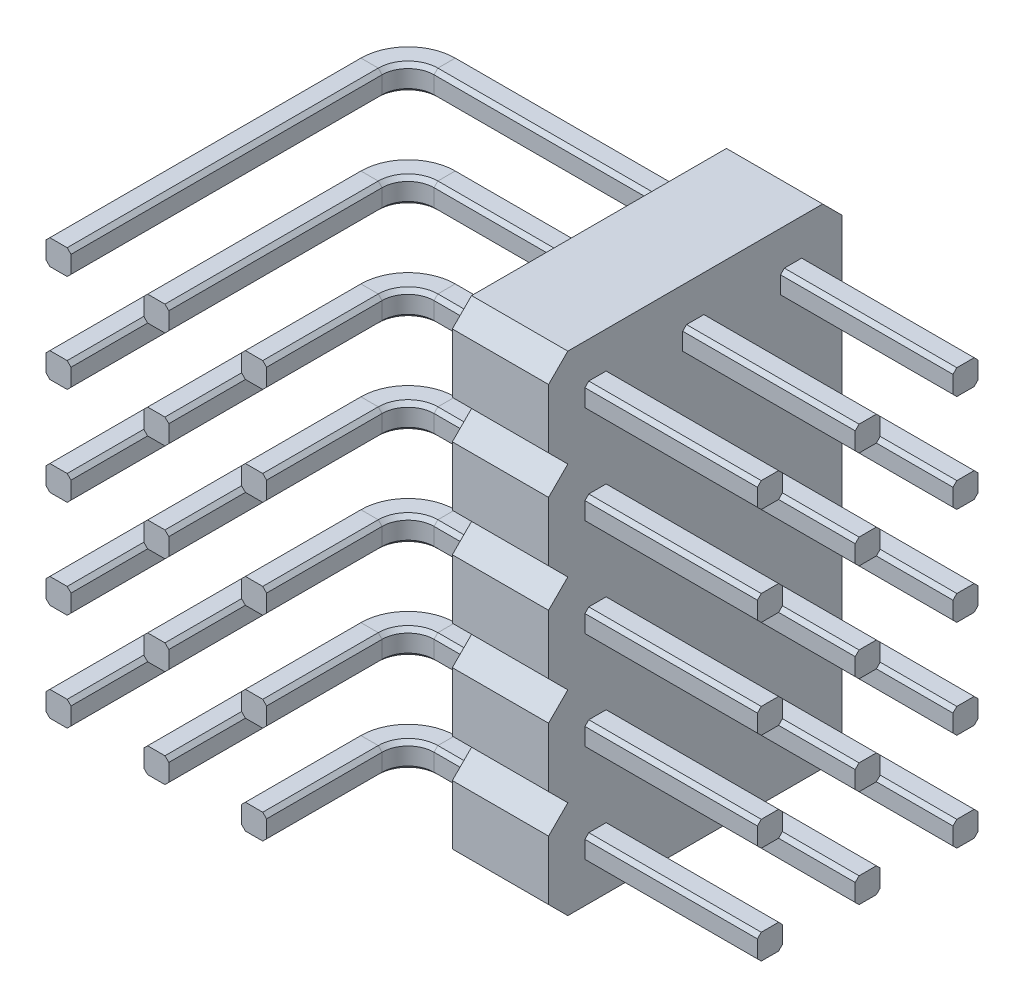
from build123d import *

# Parameters (mm, degrees)
BOSS_EXTRUDE1_DEPTH = 2.5
LPATTERN1_COUNT     = 5
LPATTERN1_PITCH     = 2.54


with BuildPart() as part:
    # Sweep2: sweep along a path in Sketch2
    with BuildLine(Plane(origin=(0, 0, 0), x_dir=(1, 0, 0), z_dir=(0, 1, 0))) as sweep2_path:
        Line((0, 0), (0, 8.08))
        ThreePointArc((0, 8.08), (0.292893219, 8.787106781), (1, 9.08))
        Line((1, 9.08), (14.48, 9.08))
    # Sketch1 → Sweep2 (sweep)
    with BuildSketch(Plane.XY):
        Polygon((-0.325, 0.225), (-0.225, 0.325), (0.225, 0.325), (0.325, 0.225), (0.325, -0.225), (0.225, -0.325), (-0.225, -0.325), (-0.325, -0.225), align=None)
    sweep(path=sweep2_path.line)



with BuildPart() as body_2:
    # Sweep3: sweep along a path in Sketch2<3>
    with BuildLine(Plane(origin=(0, 0, 0), x_dir=(1, 0, 0), z_dir=(0, 1, 0))) as sweep3_path:
        Line((2.54, 0), (2.54, 5.54))
        ThreePointArc((2.54, 5.54), (2.832893219, 6.247106781), (3.54, 6.54))
        Line((3.54, 6.54), (14.48, 6.54))
    # Sketch1<3> → Sweep3 (sweep)
    with BuildSketch(Plane.XY):
        Polygon((2.315, -0.325), (2.765, -0.325), (2.865, -0.225), (2.865, 0.225), (2.765, 0.325), (2.315, 0.325), (2.215, 0.225), (2.215, -0.225), align=None)
    sweep(path=sweep3_path.line)


with BuildPart() as body_3:
    # Sweep4: sweep along a path in Sketch2<4>
    with BuildLine(Plane(origin=(0, 0, 0), x_dir=(1, 0, 0), z_dir=(0, 1, 0))) as sweep4_path:
        Line((5.08, 0), (5.08, 3))
        ThreePointArc((5.08, 3), (5.372893219, 3.707106781), (6.08, 4))
        Line((6.08, 4), (14.48, 4))
    # Sketch1<4> → Sweep4 (sweep)
    with BuildSketch(Plane.XY):
        Polygon((4.855, -0.325), (5.305, -0.325), (5.405, -0.225), (5.405, 0.225), (5.305, 0.325), (4.855, 0.325), (4.755, 0.225), (4.755, -0.225), align=None)
    sweep(path=sweep4_path.line)


with BuildPart() as part_1:
    add(part.part)

    add(body_2.part)  # Boss-Extrude1 merges body 2

    add(body_3.part)  # Boss-Extrude1 merges body 3
    # Sketch3 → Boss-Extrude1 (add)
    with BuildSketch(Plane(origin=(7.5, 0, 0), x_dir=(0, 0, -1), z_dir=(1, 0, 0))):
        Polygon((3.23, 1.27), (9.85, 1.27), (10.35, 0.77), (10.35, -0.77), (9.85, -1.27), (3.23, -1.27), (2.73, -0.77), (2.73, 0.77), align=None)
    extrude(amount=BOSS_EXTRUDE1_DEPTH)


with BuildPart() as lpattern1_1:
    # LPattern1: pattern copy
    add(part_1.part.moved(Location(Vector(0, -1, 0) * (1 * LPATTERN1_PITCH))))


with BuildPart() as lpattern1_2:
    # LPattern1: pattern copy
    add(part_1.part.moved(Location(Vector(0, -1, 0) * (2 * LPATTERN1_PITCH))))


with BuildPart() as lpattern1_3:
    # LPattern1: pattern copy
    add(part_1.part.moved(Location(Vector(0, -1, 0) * (3 * LPATTERN1_PITCH))))


with BuildPart() as lpattern1_4:
    # LPattern1: pattern copy
    add(part_1.part.moved(Location(Vector(0, -1, 0) * (4 * LPATTERN1_PITCH))))


with BuildPart() as lpattern1_1_1:
    add(lpattern1_1.part)

    # Combine1: union part, LPattern1_2, LPattern1_3, LPattern1_4
    add(part_1.part)
    add(lpattern1_2.part)
    add(lpattern1_3.part)
    add(lpattern1_4.part)


solid = lpattern1_1_1.part
